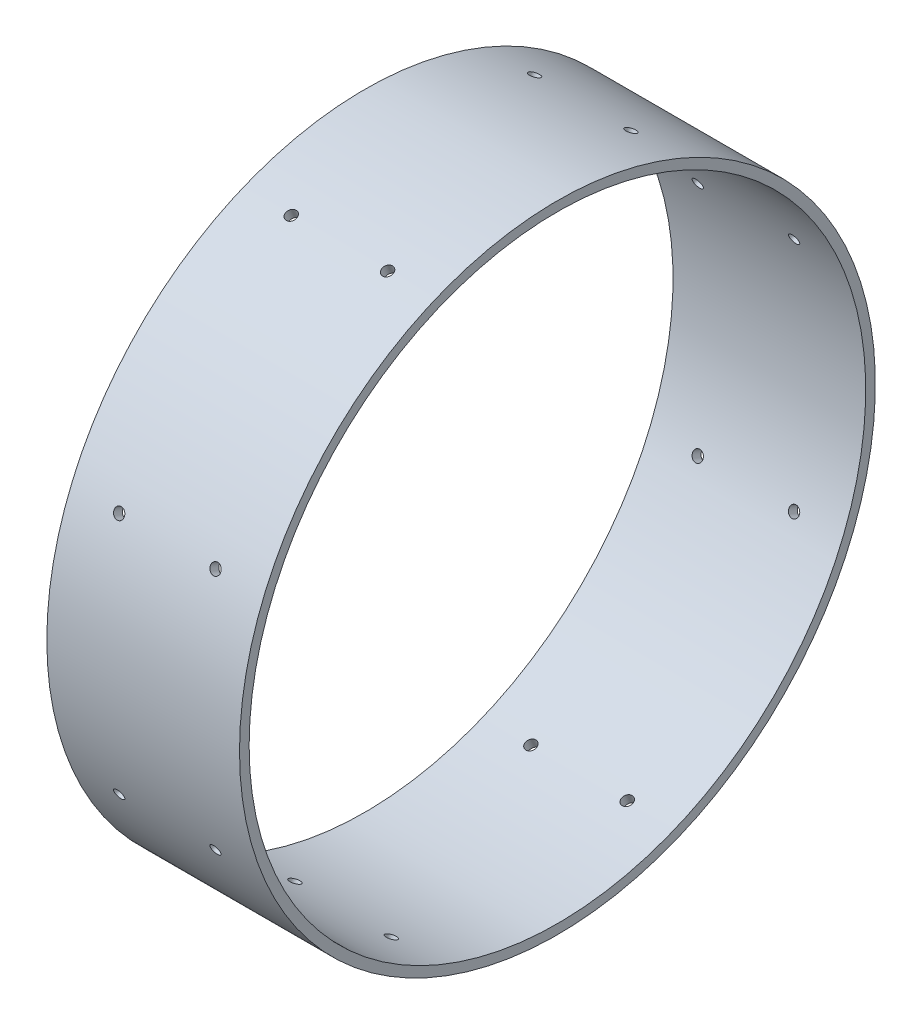
from build123d import *

# Parameters (mm, degrees)
RING_SKETCH_W        = 60
RING_SKETCH_H        = 3
SCREW_START          = -95
SCREW_HOLES_SKETCH_R = 1.65
SCREW_HOLES_DEPTH    = 5
SCREW_HOLES_X8_COUNT = 8


with BuildPart() as part:
    # Ring Sketch → Ring (revolve)
    with BuildSketch(Plane.XY, mode=Mode.PRIVATE) as ring_sk:
        with Locations((0, 97.5)):
            Rectangle(RING_SKETCH_W, RING_SKETCH_H)
    revolve(ring_sk.sketch.rotate(Axis((-400, 0, 0), (1, 0, 0)), 90), axis=Axis((-400, 0, 0), (1, 0, 0)))

    # Screw Holes Sketch → Screw Holes (cut)
    with BuildSketch(Plane(origin=(0, 0, 0), x_dir=(-1, 0, 0), z_dir=(0, -0.9238795325112867, -0.3826834323650897)).offset(SCREW_START)):
        with Locations(Location((-15, 0, 0), (0, 0, 90))):
            Circle(SCREW_HOLES_SKETCH_R)
        with Locations(Location((15, 0, 0), (0, 0, 90))):
            Circle(SCREW_HOLES_SKETCH_R)
    screw_holes = extrude(amount=-SCREW_HOLES_DEPTH, mode=Mode.SUBTRACT)

    # Screw Holes x8: Screw Holes ×8 about axis
    screw_holes_x8_axis = Axis((33, 0, 0), (-1, 0, 0))
    for i in range(1, SCREW_HOLES_X8_COUNT):
        add(screw_holes.rotate(screw_holes_x8_axis, i * 360 / SCREW_HOLES_X8_COUNT), mode=Mode.SUBTRACT)


solid = part.part
